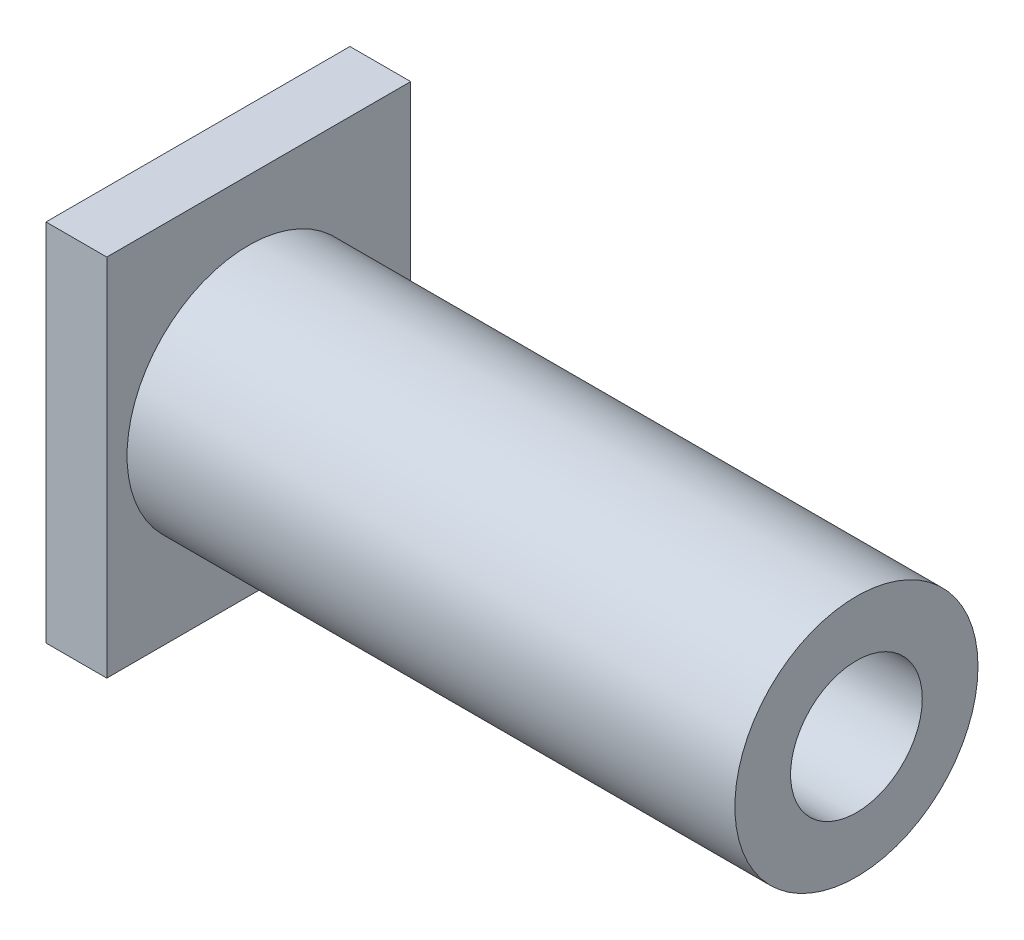
from build123d import *

# Parameters (mm, degrees)
SKETCH1_W           = 18
SKETCH1_H           = 15
SKETCH1_R           = 3.25
BOSS_EXTRUDE1_DEPTH = 3
SKETCH2_R           = 6
SKETCH2_R_2         = 3.25
BOSS_EXTRUDE2_DEPTH = 30


with BuildPart() as part:
    # Sketch1 → Boss-Extrude1 (new body)
    with BuildSketch(Plane.YZ):
        with Locations((2.662827036, 1.188789176)):
            Rectangle(SKETCH1_W, SKETCH1_H)
        with Locations(Location((2.662827036, 1.688789176, 0), (0, 0, 270))):
            Circle(SKETCH1_R, mode=Mode.SUBTRACT)
    extrude(amount=BOSS_EXTRUDE1_DEPTH)

    # Sketch2 → Boss-Extrude2 (add)
    with BuildSketch(Plane.YZ.offset(3)):
        with Locations(Location((2.662827036, 1.688789176, 0), (0, 0, 270))):
            Circle(SKETCH2_R)
        with Locations(Location((2.662827036, 1.688789176, 0), (0, 0, 270))):
            Circle(SKETCH2_R_2, mode=Mode.SUBTRACT)
    extrude(amount=BOSS_EXTRUDE2_DEPTH)


solid = part.part
